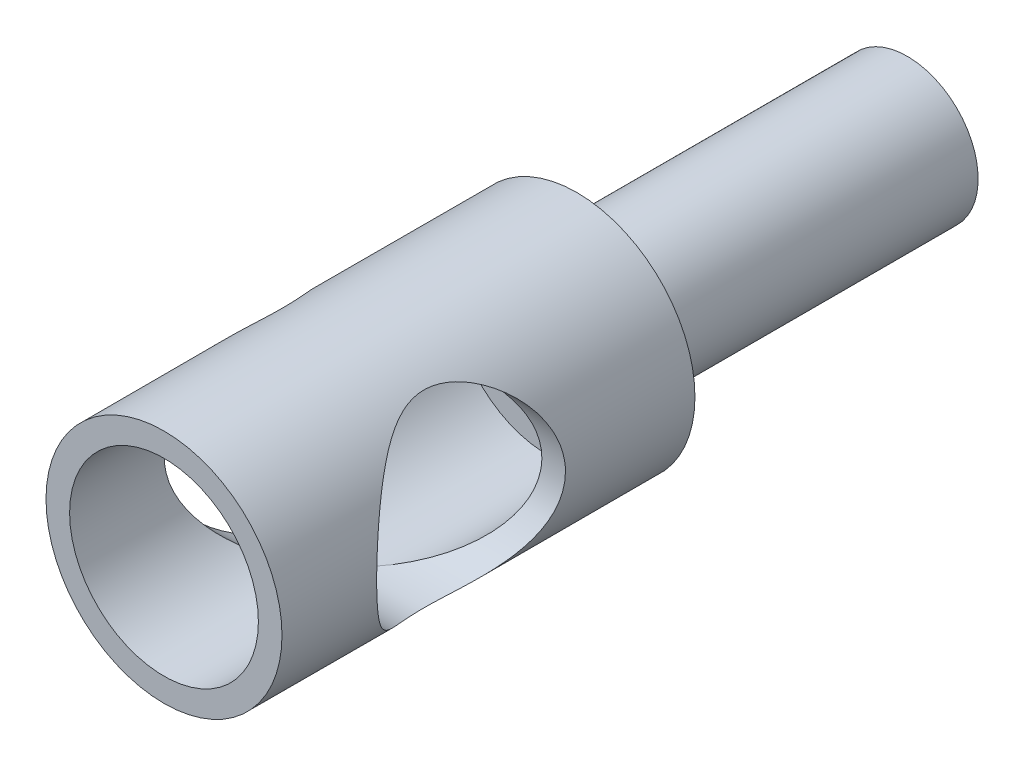
from build123d import *

# Parameters (mm, degrees)
SKETCH_1_R          = 1
EXTRUDE_1_DEPTH     = 3.5
SKETCH_3_R          = 0.6
EXTRUDE_2_DEPTH     = 2.8
SKETCH_4_R          = 0.8
CUT_EXTRUDE_1_DEPTH = 1.25
SKETCH_5_R          = 0.8
CUT_EXTRUDE_2_DEPTH = 3.25


with BuildPart() as part:
    # 草图1 → 凸台-拉伸1 (new body)
    with BuildSketch(Plane.XY):
        Circle(SKETCH_1_R)
    extrude(amount=EXTRUDE_1_DEPTH)

    # 草图3 → 凸台-拉伸2 (add)
    with BuildSketch(Plane(origin=(0, 0, 0), x_dir=(-1, 0, 0), z_dir=(0, 0, -1))):
        Circle(SKETCH_3_R)
    extrude(amount=EXTRUDE_2_DEPTH)

    # 草图4 → 切除-拉伸1 (cut, symmetric)
    with BuildSketch(Plane(origin=(0, 0, 0), x_dir=(0, 0, -1), z_dir=(1, 0, 0))):
        with Locations(Location((-1.897429081, 0, 0), (0, 0, 180.000000009))):
            Circle(SKETCH_4_R)
    extrude(amount=CUT_EXTRUDE_1_DEPTH, both=True, mode=Mode.SUBTRACT)

    # 草图5 → 切除-拉伸2 (cut, symmetric)
    with BuildSketch(Plane.XY.offset(3.5)):
        Circle(SKETCH_5_R)
    extrude(amount=CUT_EXTRUDE_2_DEPTH, both=True, mode=Mode.SUBTRACT)


solid = part.part
